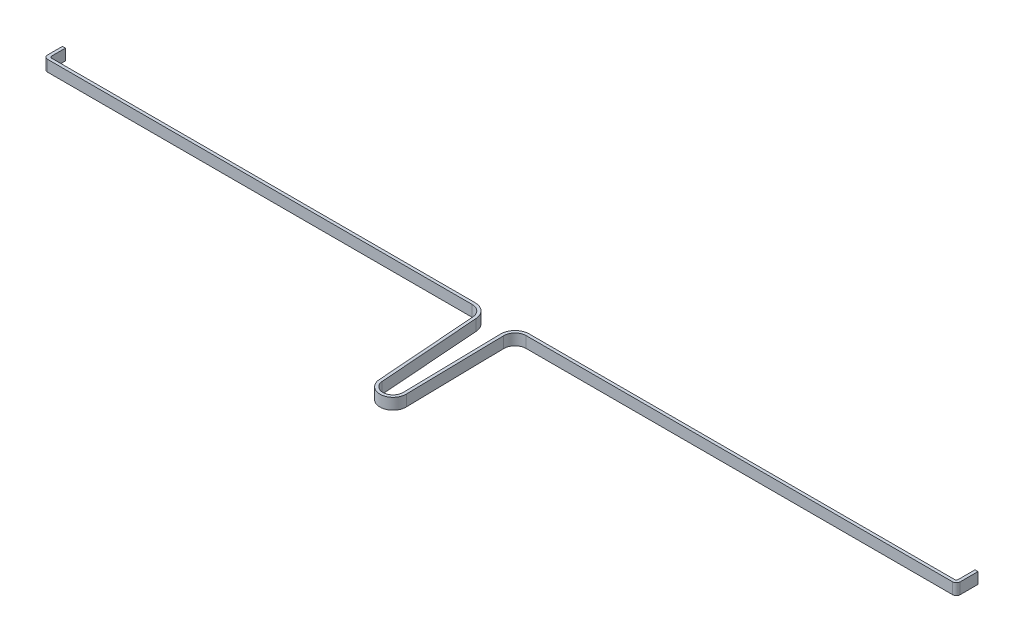
from build123d import *

# Parameters (mm, degrees)
SKETCH1_W           = 1.6
SKETCH1_H           = 8.4
SKETCH1_H_2         = 1.6
SKETCH1_H_3         = 10
BOSS_EXTRUDE1_DEPTH = 6
FILLET1_R           = 1
FILLET2_R           = 2


with BuildPart() as part:
    # Sketch1 → Boss-Extrude1 (new body)
    with BuildSketch(Plane(origin=(0, 0, 0), x_dir=(1, 0, 0), z_dir=(0, 1, 0))):
        with Locations((-246.2, 65.3)):
            Rectangle(SKETCH1_W, SKETCH1_H)
        with Locations((-246.2, 60.3)):
            Rectangle(SKETCH1_W, SKETCH1_H_2)
        with BuildLine():
            Line((-245.4, 59.5), (-17, 59.5))
            ThreePointArc((-17, 59.5), (-12.917127972, 57.896607329), (-11.016404973, 53.943385336))
            Line((-11.016404973, 53.943385336), (-6.980860865, -0.517282892))
            ThreePointArc((-6.980860865, -0.517282892), (0.324323403, -6.992482701), (6.998771924, 0.131116578))
            Line((6.998771924, 0.131116578), (6.001052637, 53.387614362))
            ThreePointArc((6.001052637, 53.387614362), (7.717809332, 57.702718535), (12, 59.5))
            Line((12, 59.5), (241.4, 59.5))
            Line((241.4, 59.5), (241.4, 61.1))
            Line((241.4, 61.1), (12, 61.1))
            ThreePointArc((12, 61.1), (6.575891821, 58.823443478), (4.40133334, 53.357644858))
            Line((4.40133334, 53.357644858), (5.399052627, 0.101147074))
            ThreePointArc((5.399052627, 0.101147074), (0.250192339, -5.394200941), (-5.385235524, -0.399046802))
            Line((-5.385235524, -0.399046802), (-9.420779633, 54.061621425))
            ThreePointArc((-9.420779633, 54.061621425), (-11.828362098, 59.06903595), (-17, 61.1))
            Line((-17, 61.1), (-245.4, 61.1))
            Line((-245.4, 61.1), (-245.4, 59.5))
        make_face()
        with Locations((242.2, 60.3)):
            Rectangle(SKETCH1_W, SKETCH1_H_2)
        with Locations((242.2, 66.1)):
            Rectangle(SKETCH1_W, SKETCH1_H_3)
    extrude(amount=BOSS_EXTRUDE1_DEPTH)

    # Fillet1
    fillet1_edges = [part.edges().sort_by_distance(p)[0] for p in [
        (-245.4, 3, -61.1),
        (241.4, 3, -61.1),
    ]]
    fillet(fillet1_edges, radius=FILLET1_R)

    # Fillet2
    fillet2_edges = [part.edges().sort_by_distance(p)[0] for p in [
        (243, 3, -59.5),
        (-247, 3, -59.5),
    ]]
    fillet(fillet2_edges, radius=FILLET2_R)


solid = part.part
